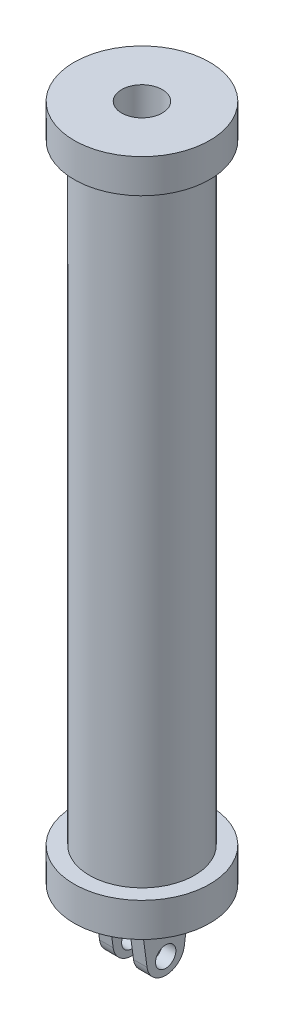
from build123d import *

# Parameters (mm, degrees)
SKETCH3_R           = 3
CUT_EXTRUDE1_DEPTH  = 5
SKETCH4_W           = 2
SKETCH4_H           = 7.5
BOSS_EXTRUDE2_DEPTH = 10
SKETCH6_R           = 1.5
CUT_EXTRUDE2_DEPTH  = 10


with BuildPart() as part:
    # Sketch1 → Revolve2 (revolve)
    with BuildSketch(Plane.XY, mode=Mode.PRIVATE) as revolve2_sk:
        Polygon((0, 100), (10, 100), (10, 95), (7.75, 95), (7.75, 5), (10, 5), (10, 0), (0, 0), (0, 5), (5, 5), (5, 95), (0, 95), align=None)
    revolve(revolve2_sk.sketch.rotate(Axis((0, 100, 0), (0, -1, 0)), 180), axis=Axis((0, 100, 0), (0, -1, 0)))

    # Sketch3 → Cut-Extrude1 (cut)
    with BuildSketch(Plane(origin=(0, 100, 0), x_dir=(1, 0, 0), z_dir=(0, 1, 0))):
        with Locations(Location((0, 0, 0), (0, 0, 180))):
            Circle(SKETCH3_R)
    extrude(amount=-CUT_EXTRUDE1_DEPTH, mode=Mode.SUBTRACT)

    # Sketch4 → Boss-Extrude2 (add)
    with BuildSketch(Plane.XZ):
        with Locations((-2.5, 0)):
            Rectangle(SKETCH4_W, SKETCH4_H)
        with Locations((2.5, 0)):
            Rectangle(SKETCH4_W, SKETCH4_H)
    extrude(amount=BOSS_EXTRUDE2_DEPTH)

    # Sketch6 → Cut-Extrude2 (cut)
    with BuildSketch(Plane(origin=(3.5, 0, 0), x_dir=(0, 0, -1), z_dir=(1, 0, 0))):
        with Locations(Location((0, -7.5, 0), (0, 0, 90))):
            Circle(SKETCH6_R)
        with BuildLine():
            Line((-3.75, 0), (-2.75, -7.5))
            ThreePointArc((-2.75, -7.5), (0, -9.907670091), (2.75, -7.5))
            Line((2.75, -7.5), (3.75, 0))
            Line((3.75, 0), (3.75, -10))
            Line((3.75, -10), (-3.75, -10))
            Line((-3.75, -10), (-3.75, 0))
        make_face()
    extrude(amount=-CUT_EXTRUDE2_DEPTH, mode=Mode.SUBTRACT)


solid = part.part
